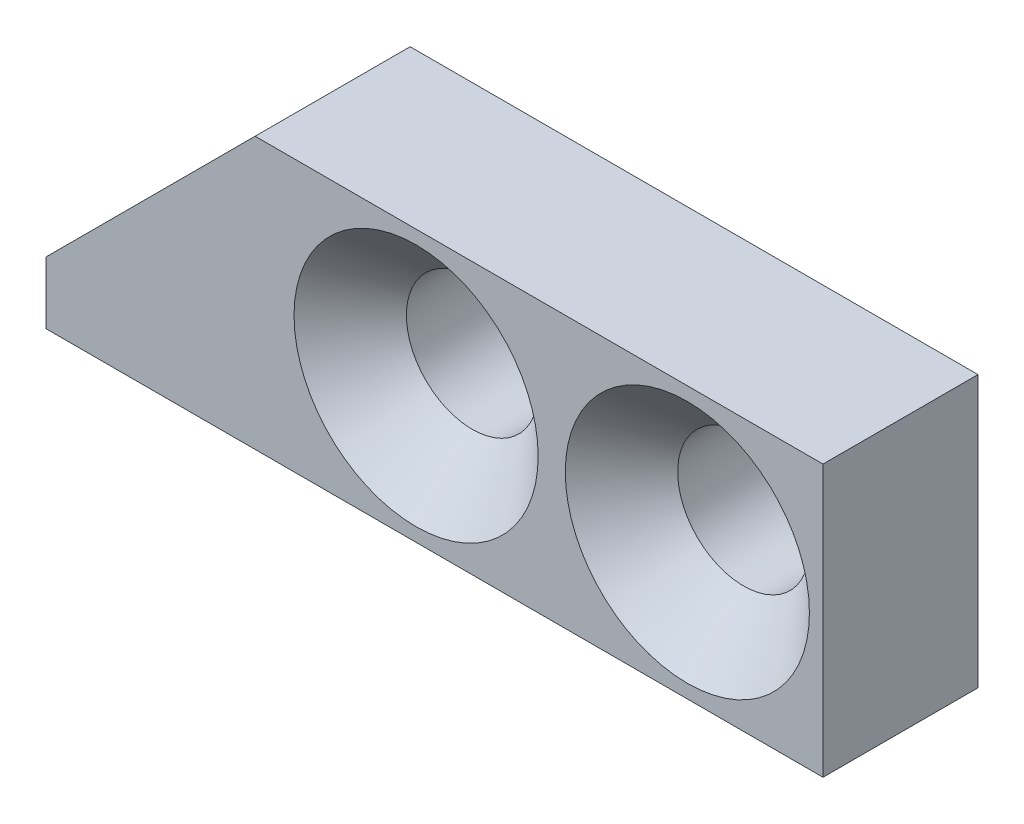
from build123d import *

# Parameters (mm, degrees)
BOSS_EXTRUDE1_DEPTH                                 = 4
CSK_FOR_M3_COUNTERSUNK_FLAT_HEAD_SCREW1_D           = 3.4
CSK_FOR_M3_COUNTERSUNK_FLAT_HEAD_SCREW1_CSINK_D     = 6.3
CSK_FOR_M3_COUNTERSUNK_FLAT_HEAD_SCREW1_CSINK_ANGLE = 90
TAP_DRILL_FOR_M2_TAP1_D                             = 1.9


with BuildPart() as part:
    # Sketch1 → Boss-Extrude1 (new body)
    with BuildSketch(Plane.XY):
        Polygon((5.396358967, 7), (20.05, 7), (20.05, 0), (0, 0), (0, 1.603641033), align=None)
    extrude(amount=BOSS_EXTRUDE1_DEPTH)

    # CSK for M3 Countersunk Flat Head Screw1 (through all)
    with Locations(Plane.XY.offset(4)):
        with Locations((16.55, 3.5), (9.55, 3.5)):
            CounterSinkHole(CSK_FOR_M3_COUNTERSUNK_FLAT_HEAD_SCREW1_D / 2, CSK_FOR_M3_COUNTERSUNK_FLAT_HEAD_SCREW1_CSINK_D / 2, counter_sink_angle=CSK_FOR_M3_COUNTERSUNK_FLAT_HEAD_SCREW1_CSINK_ANGLE)

    # Tap Drill for M2 Tap1 (through all)
    with Locations(Plane(origin=(-0.801820516, 0.801820516, 0), x_dir=(0.7071067811865511, 0.707106781186544, 0), z_dir=(-0.707106781186544, 0.7071067811865511, 0))):
        with Locations((4.949747468, -2)):
            Hole(TAP_DRILL_FOR_M2_TAP1_D / 2)


solid = part.part
